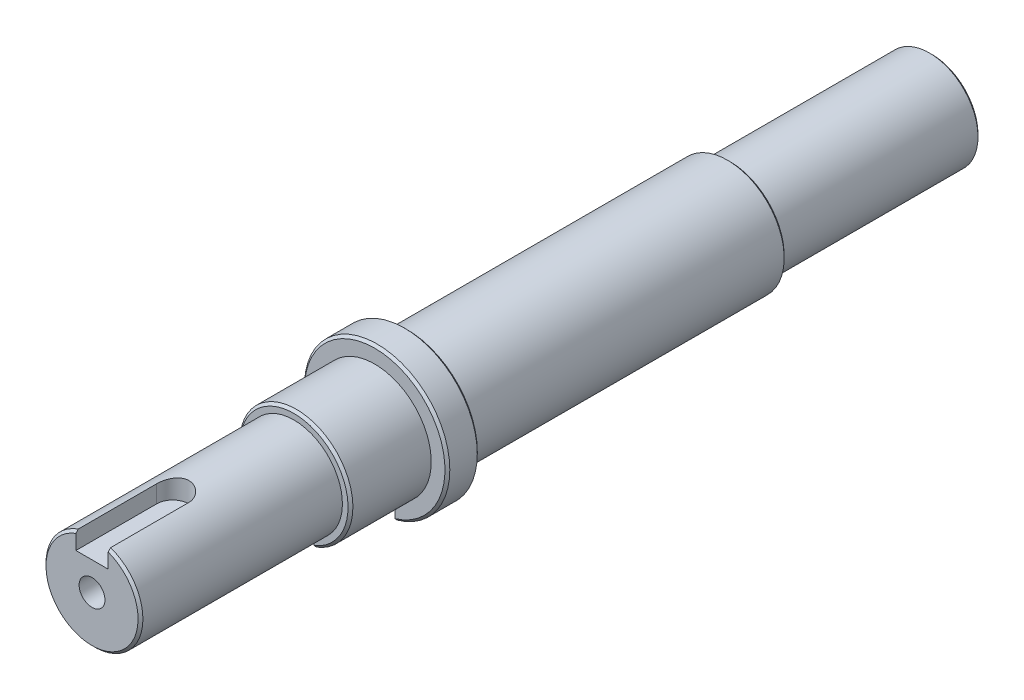
from build123d import *

# Parameters (mm, degrees)
SKETCH1_R      = 7
EXTRUDE1_DEPTH = 37
EXTRUDE5_START = -20
SKETCH5_R      = 9
EXTRUDE5_DEPTH = 4
EXTRUDE3_START = -4
EXTRUDE3_DEPTH = 36.127995093
SKETCH4_R      = 7
SKETCH4_R_2    = 6
EXTRUDE4_DEPTH = 10
SKETCH6_R      = 6
EXTRUDE6_DEPTH = 15
CHAMFER1_SIZE  = 0.3
SKETCH7_R      = 1.6
EXTRUDE7_DEPTH = 12
EXTRUDE8_START = -3.5
EXTRUDE8_DEPTH = 12
EXTRUDE9_START = 3.5
EXTRUDE9_DEPTH = 51.035035296


with BuildPart() as part:
    # Sketch1 → Extrude1 (new, symmetric)
    with BuildSketch(Plane.XY):
        Circle(SKETCH1_R)
    extrude(amount=EXTRUDE1_DEPTH, both=True)

    # Sketch5 → Extrude5 (add)
    with BuildSketch(Plane.XY.offset(37).offset(EXTRUDE5_START)):
        Circle(SKETCH5_R)
    extrude(amount=-EXTRUDE5_DEPTH)

    # Sketch3 → Extrude3 (cut, through all)
    with BuildSketch(Plane(origin=(0, 0, 0), x_dir=(1, 0, 0), z_dir=(0, 1, 0)).offset(EXTRUDE3_START)):
        with BuildLine():
            Line((-2.5, -27), (-2.5, -17))
            ThreePointArc((-2.5, -17), (0, -14.5), (2.5, -17))
            Line((2.5, -17), (2.5, -27))
            ThreePointArc((2.5, -27), (0, -29.5), (-2.5, -27))
        make_face()
    extrude(amount=-EXTRUDE3_DEPTH, mode=Mode.SUBTRACT)

    # Sketch4 → Extrude4 (cut)
    with BuildSketch(Plane.XY.offset(37)):
        Circle(SKETCH4_R)
        Circle(SKETCH4_R_2, mode=Mode.SUBTRACT)
    extrude4 = extrude(amount=-EXTRUDE4_DEPTH, mode=Mode.SUBTRACT)

    # Mirror1: Extrude4 across plane
    add(extrude4.mirror(Plane.XY), mode=Mode.SUBTRACT)

    # Sketch6 → Extrude6 (add)
    with BuildSketch(Plane.XY.offset(37)):
        Circle(SKETCH6_R)
    extrude6 = extrude(amount=EXTRUDE6_DEPTH)

    # Mirror2: Extrude6 across plane
    add(extrude6.mirror(Plane.XY))

    # Chamfer1
    chamfer1_edges = [part.edges().sort_by_distance(p)[0] for p in [
        (-6, 0, 52),
        (-6, 0, -52),
        (-7, 0, -27),
        (-9, 0, 13),
        (-5.408326913, 7.193747285, 17),
        (0, 7, 27),
    ]]
    chamfer(chamfer1_edges, length=CHAMFER1_SIZE)

    # Sketch7 → Extrude7 (cut)
    with BuildSketch(Plane.XY.offset(52)):
        Circle(SKETCH7_R)
    extrude7 = extrude(amount=-EXTRUDE7_DEPTH, mode=Mode.SUBTRACT)

    # Mirror3: Extrude7 across plane
    add(extrude7.mirror(Plane.XY), mode=Mode.SUBTRACT)

    # Sketch8 → Extrude8 (cut)
    with BuildSketch(Plane(origin=(0, 0, 0), x_dir=(1, 0, 0), z_dir=(0, 1, 0)).offset(EXTRUDE8_START)):
        with BuildLine():
            Line((2, 52), (2, 42))
            ThreePointArc((2, 42), (0, 40), (-2, 42))
            Line((-2, 42), (-2, 52))
            ThreePointArc((-2, 52), (0, 54), (2, 52))
        make_face()
    extrude(amount=-EXTRUDE8_DEPTH, mode=Mode.SUBTRACT)

    # Sketch9 → Extrude9 (cut, through all)
    with BuildSketch(Plane(origin=(0, 0, 0), x_dir=(1, 0, 0), z_dir=(0, 1, 0)).offset(EXTRUDE9_START)):
        with BuildLine():
            Line((-2, -52), (-2, -42))
            ThreePointArc((-2, -42), (0, -40), (2, -42))
            Line((2, -42), (2, -52))
            ThreePointArc((2, -52), (0, -54), (-2, -52))
        make_face()
    extrude(amount=EXTRUDE9_DEPTH, mode=Mode.SUBTRACT)


solid = part.part
